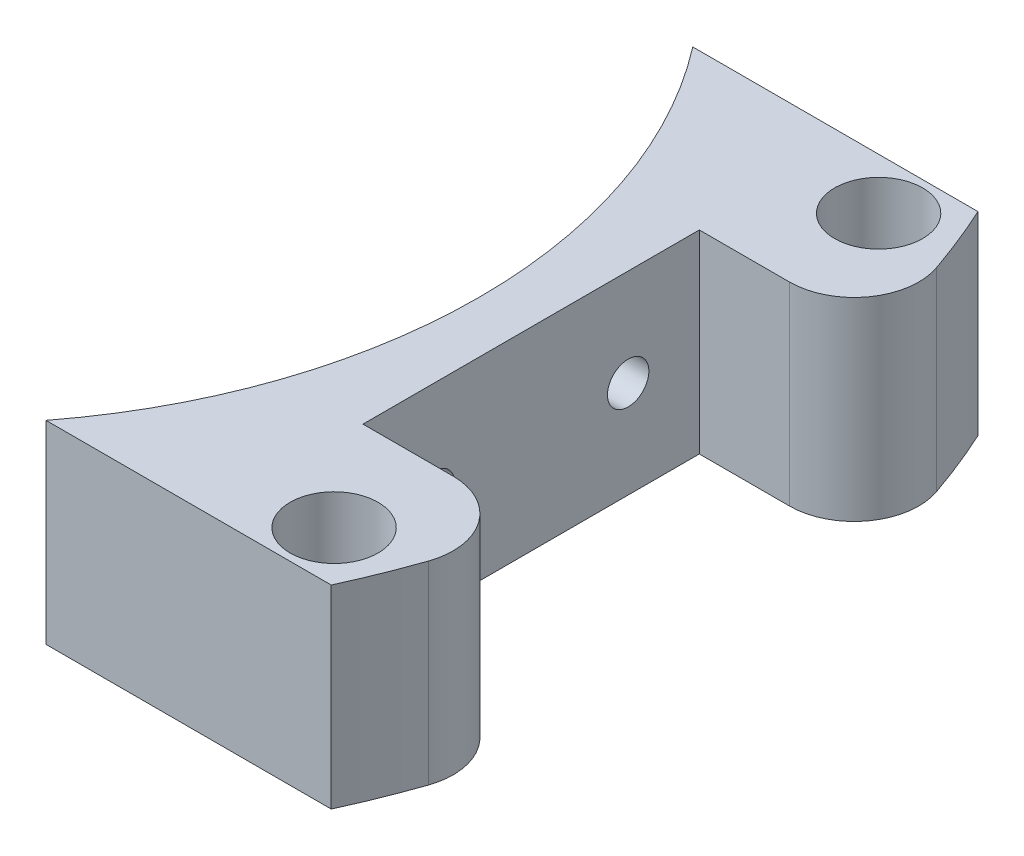
from build123d import *

# Parameters (mm, degrees)
SKETCH_1_R          = 3.4
EXTRUDE_2_DEPTH     = 15
CUT_EXTRUDE_1_DEPTH = 104.680547991
CUT_EXTRUDE_2_DEPTH = 103.721548766
CUT_EXTRUDE_START   = -10
SKETCH_6_R          = 2.5
SKETCH_6_R_2        = 1.6
CUT_EXTRUDE_3_DEPTH = 10
FILLET_1_R          = 5


with BuildPart() as part:
    # 草图1 → 凸台-拉伸2 (new body)
    with BuildSketch(Plane(origin=(0, 0, 0), x_dir=(1, 0, 0), z_dir=(0, 1, 0))):
        with BuildLine():
            ThreePointArc((-7.95357839, 100.709696918), (0.550267992, 75.709696918), (-7.95357839, 50.709696918))
            Line((-7.95357839, 50.709696918), (14.093828565, 50.709696918))
            ThreePointArc((14.093828565, 50.709696918), (19.550267992, 75.709696918), (14.093828565, 100.709696918))
            Line((14.093828565, 100.709696918), (-7.95357839, 100.709696918))
        make_face()
        with Locations(Location((10.36364228, 96.757285698, 0), (0, 0, 270))):
            Circle(SKETCH_1_R, mode=Mode.SUBTRACT)
        with Locations(Location((10.36364228, 54.662108138, 0), (0, 0, 270))):
            Circle(SKETCH_1_R, mode=Mode.SUBTRACT)
    extrude(amount=EXTRUDE_2_DEPTH)

    # 草图2 → 切除-拉伸1 (cut, through all)
    with BuildSketch(Plane(origin=(0, 15, 0), x_dir=(1, 0, 0), z_dir=(0, 1, 0))):
        with BuildLine():
            Line((4.550267992, 88.709696918), (4.550267992, 75.709696918))
            Line((4.550267992, 75.709696918), (19.550267992, 75.709696918))
            ThreePointArc((19.550267992, 75.709696918), (19.192888302, 82.248645039), (18.125006574, 88.709696918))
            Line((18.125006574, 88.709696918), (4.550267992, 88.709696918))
        make_face()
        with BuildLine():
            Line((19.550267992, 75.709696918), (4.550267992, 75.709696918))
            Line((4.550267992, 75.709696918), (4.550267992, 62.709696918))
            Line((4.550267992, 62.709696918), (18.125006574, 62.709696918))
            ThreePointArc((18.125006574, 62.709696918), (19.192888302, 69.170748797), (19.550267992, 75.709696918))
        make_face()
    extrude(amount=-CUT_EXTRUDE_1_DEPTH, mode=Mode.SUBTRACT)

    # 草图4 → 切除-拉伸2 (cut, through all)
    with BuildSketch(Plane(origin=(4.550267992, 0, 0), x_dir=(0, 0, -1), z_dir=(1, 0, 0))):
        with BuildLine():
            ThreePointArc((84.809696918, 7.5), (83.209696918, 9.1), (81.609696918, 7.5))
            Line((81.609696918, 7.5), (84.809696918, 7.5))
        make_face()
        with BuildLine():
            Line((84.809696918, 7.5), (81.609696918, 7.5))
            ThreePointArc((81.609696918, 7.5), (83.209696918, 5.9), (84.809696918, 7.5))
        make_face()
        with BuildLine():
            ThreePointArc((69.809696918, 7.5), (68.209696918, 9.1), (66.609696918, 7.5))
            Line((66.609696918, 7.5), (69.809696918, 7.5))
        make_face()
        with BuildLine():
            Line((69.809696918, 7.5), (66.609696918, 7.5))
            ThreePointArc((66.609696918, 7.5), (68.209696918, 5.9), (69.809696918, 7.5))
        make_face()
    extrude(amount=-CUT_EXTRUDE_2_DEPTH, mode=Mode.SUBTRACT)

    # 草图6 → 切除-拉伸3 (cut)
    # profile 1 of 2: a face of its own
    with BuildSketch(Plane.ZY.offset(7.95357839).offset(CUT_EXTRUDE_START)):
        with Locations((-83.209696918, 7.5)):
            Circle(SKETCH_6_R)
        with Locations(Location((-83.209696918, 7.5, 0), (0, 0, 180))):
            Circle(SKETCH_6_R_2, mode=Mode.SUBTRACT)
    # profile 2 of 2: a face of its own
    with BuildSketch(Plane.ZY.offset(7.95357839).offset(CUT_EXTRUDE_START)):
        with Locations((-68.209696918, 7.5)):
            Circle(SKETCH_6_R)
        with Locations(Location((-68.209696918, 7.5, 0), (0, 0, 180))):
            Circle(SKETCH_6_R_2, mode=Mode.SUBTRACT)
    extrude(amount=CUT_EXTRUDE_3_DEPTH, mode=Mode.SUBTRACT)

    # 圆角1
    fillet_1_edges = [part.edges().sort_by_distance(p)[0] for p in [
        (18.125006574, 7.5, -88.709696918),
        (18.125006574, 7.5, -62.709696918),
    ]]
    fillet(fillet_1_edges, radius=FILLET_1_R)


solid = part.part
